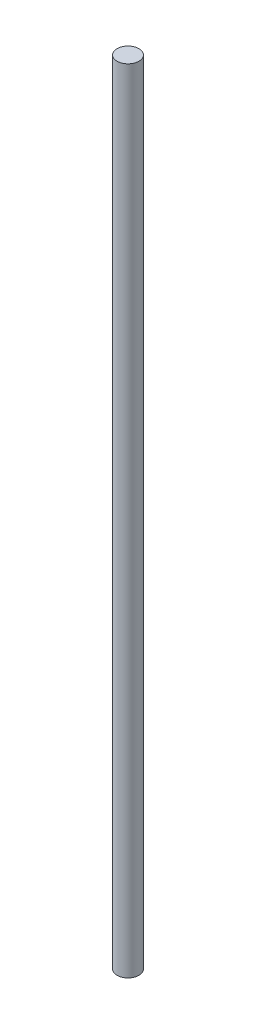
from build123d import *

# Parameters (mm, degrees)
SKETCH_1_R      = 2
EXTRUDE_1_DEPTH = 145


with BuildPart() as part:
    # 草图1 → 凸台-拉伸1 (new body)
    with BuildSketch(Plane(origin=(0, 0, 0), x_dir=(1, 0, 0), z_dir=(0, 1, 0))):
        with Locations(Location((0, 0, 0), (0, 0, 270))):
            Circle(SKETCH_1_R)
    extrude(amount=EXTRUDE_1_DEPTH)


solid = part.part
